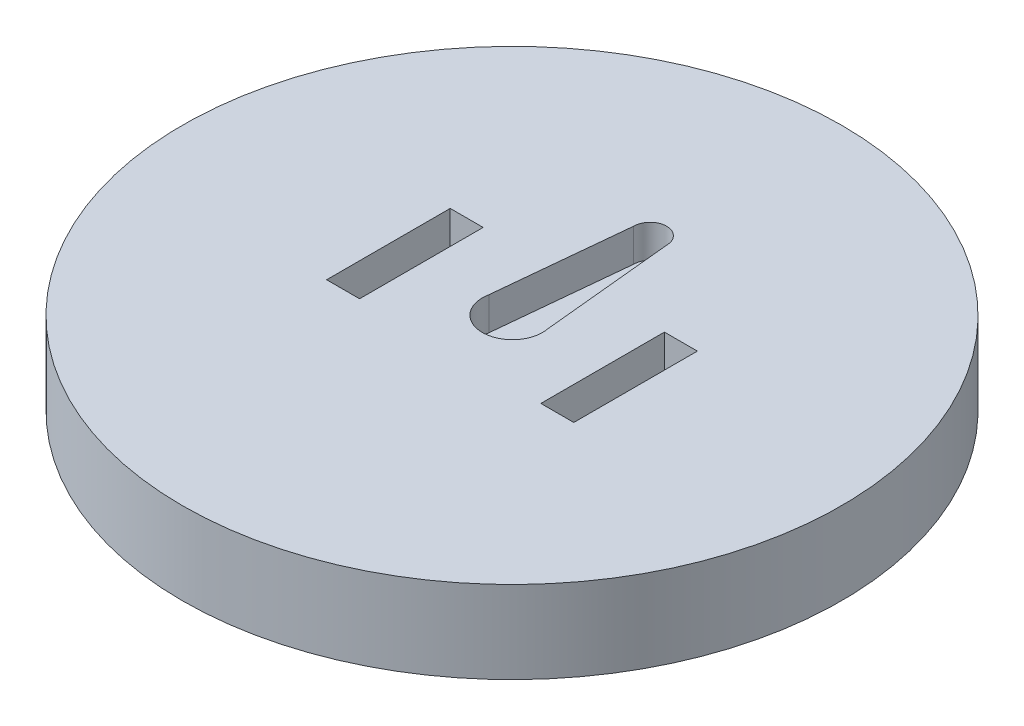
from build123d import *

# Parameters (mm, degrees)
SKETCH1_R           = 40
BOSS_EXTRUDE1_DEPTH = 10
CUT_EXTRUDE1_DEPTH  = 4
SKETCH3_W           = 4
SKETCH3_H           = 15
CUT_EXTRUDE2_DEPTH  = 10


with BuildPart() as part:
    # Sketch1 → Boss-Extrude1 (new body)
    with BuildSketch(Plane(origin=(0, 0, 0), x_dir=(1, 0, 0), z_dir=(0, 1, 0))):
        with Locations(Location((0, 0, 0), (0, 0, 270))):
            Circle(SKETCH1_R)
    extrude(amount=BOSS_EXTRUDE1_DEPTH)

    # Sketch2 → Cut-Extrude1 (cut)
    with BuildSketch(Plane(origin=(0, 10, 0), x_dir=(1, 0, 0), z_dir=(0, 1, 0))):
        with BuildLine():
            Line((-2, 16.764144262), (-3.580103784, 0.764144262))
            ThreePointArc((-3.580103784, 0.764144262), (0, -3.596740326), (3.580103784, 0.764144262))
            Line((3.580103784, 0.764144262), (2, 16.764144262))
            ThreePointArc((2, 16.764144262), (0, 18.764144262), (-2, 16.764144262))
        make_face()
    extrude(amount=-CUT_EXTRUDE1_DEPTH, mode=Mode.SUBTRACT)

    # Sketch3 → Cut-Extrude2 (cut)
    with BuildSketch(Plane.XZ):
        with Locations((13, 0)):
            Rectangle(SKETCH3_W, SKETCH3_H)
        with Locations((-13, 0)):
            Rectangle(SKETCH3_W, SKETCH3_H)
    extrude(amount=-CUT_EXTRUDE2_DEPTH, mode=Mode.SUBTRACT)


solid = part.part
